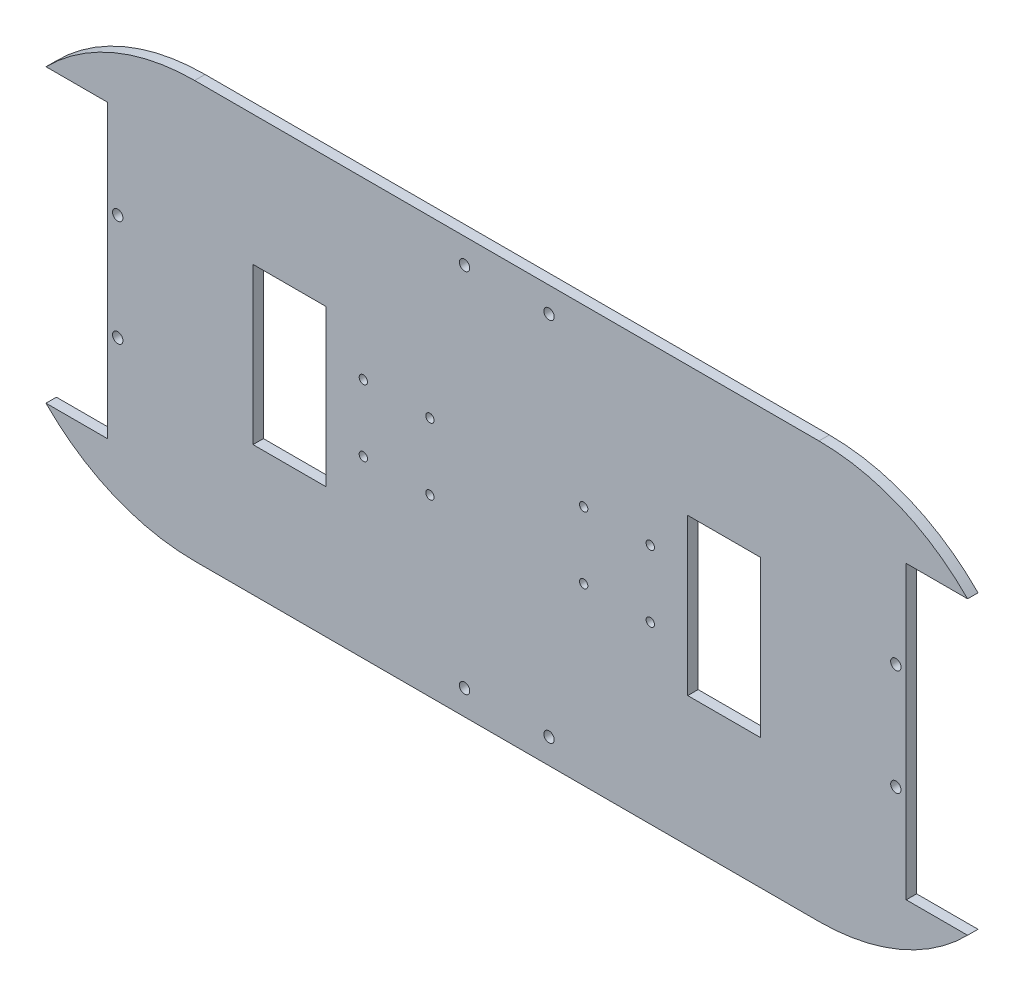
from build123d import *

# Parameters (mm, degrees)
BOSS_EXTRUDE1_DEPTH = 5
SKETCH2_R           = 2.5
SKETCH2_W           = 35
SKETCH2_H           = 75
CUT_EXTRUDE1_DEPTH  = 10
SKETCH4_R           = 2
CUT_EXTRUDE3_DEPTH  = 10
SKETCH5_R           = 2.5
CUT_EXTRUDE4_DEPTH  = 10


with BuildPart() as part:
    # Sketch1 → Boss-Extrude1 (new body)
    with BuildSketch(Plane.XY):
        with BuildLine():
            Line((77, 150.635083269), (106.477021815, 150.635083269))
            ThreePointArc((106.477021815, 150.635083269), (73.792570992, 172.830527842), (35.06273753, 180.635083269))
            Line((35.06273753, 180.635083269), (-264.93726247, 180.635083269))
            ThreePointArc((-264.93726247, 180.635083269), (-303.667095932, 172.830527842), (-336.351546756, 150.635083269))
            Line((-336.351546756, 150.635083269), (-306.874524941, 150.635083269))
            Line((-306.874524941, 150.635083269), (-306.874524941, 10.635083269))
            Line((-306.874524941, 10.635083269), (-336.351546756, 10.635083269))
            ThreePointArc((-336.351546756, 10.635083269), (-303.667095932, -11.560361304), (-264.93726247, -19.364916731))
            Line((-264.93726247, -19.364916731), (35.06273753, -19.364916731))
            ThreePointArc((35.06273753, -19.364916731), (73.792570992, -11.560361304), (106.477021815, 10.635083269))
            Line((106.477021815, 10.635083269), (77, 10.635083269))
            Line((77, 10.635083269), (77, 150.635083269))
        make_face()
    extrude(amount=-BOSS_EXTRUDE1_DEPTH)

    # Sketch2 → Cut-Extrude1 (cut)
    with BuildSketch(Plane(origin=(0, 0, -5), x_dir=(-1, 0, 0), z_dir=(0, 0, -1))):
        with Locations((301.874524941, 106.135083269)):
            Circle(SKETCH2_R)
        with Locations(Location((301.874524941, 55.135083269, 0), (0, 0, 180))):
            Circle(SKETCH2_R)
        with Locations((-72, 55.135083269)):
            Circle(SKETCH2_R)
        with Locations(Location((-72, 106.135083269, 0), (0, 0, 180))):
            Circle(SKETCH2_R)
        with Locations((219.374524941, 80.635083269)):
            Rectangle(SKETCH2_W, SKETCH2_H)
        with Locations((10.5, 80.635083269)):
            Rectangle(SKETCH2_W, SKETCH2_H)
    extrude(amount=-CUT_EXTRUDE1_DEPTH, mode=Mode.SUBTRACT)

    # Sketch4 → Cut-Extrude3 (cut)
    with BuildSketch(Plane(origin=(0, 0, -5), x_dir=(-1, 0, 0), z_dir=(0, 0, -1))):
        with Locations((46, 64.695083269)):
            Circle(SKETCH4_R)
        with Locations((46, 96.695083269)):
            Circle(SKETCH4_R)
        with Locations((78, 64.695083269)):
            Circle(SKETCH4_R)
        with Locations((78, 96.695083269)):
            Circle(SKETCH4_R)
        with Locations(Location((151.874524941, 64.695083269, 0), (0, 0, 180))):
            Circle(SKETCH4_R)
        with Locations(Location((183.874524941, 64.695083269, 0), (0, 0, 180))):
            Circle(SKETCH4_R)
        with Locations(Location((183.874524941, 96.695083269, 0), (0, 0, 180))):
            Circle(SKETCH4_R)
        with Locations(Location((151.874524941, 96.695083269, 0), (0, 0, 180))):
            Circle(SKETCH4_R)
    extrude(amount=-CUT_EXTRUDE3_DEPTH, mode=Mode.SUBTRACT)

    # Sketch5 → Cut-Extrude4 (cut)
    with BuildSketch(Plane(origin=(0, 0, -5), x_dir=(-1, 0, 0), z_dir=(0, 0, -1))):
        with Locations((94.63726247, 168.635083269)):
            Circle(SKETCH5_R)
        with Locations((135.23726247, 168.635083269)):
            Circle(SKETCH5_R)
        with Locations(Location((94.63726247, -7.364916731, 0), (0, 0, 180))):
            Circle(SKETCH5_R)
        with Locations(Location((135.23726247, -7.364916731, 0), (0, 0, 180))):
            Circle(SKETCH5_R)
    extrude(amount=-CUT_EXTRUDE4_DEPTH, mode=Mode.SUBTRACT)


solid = part.part
